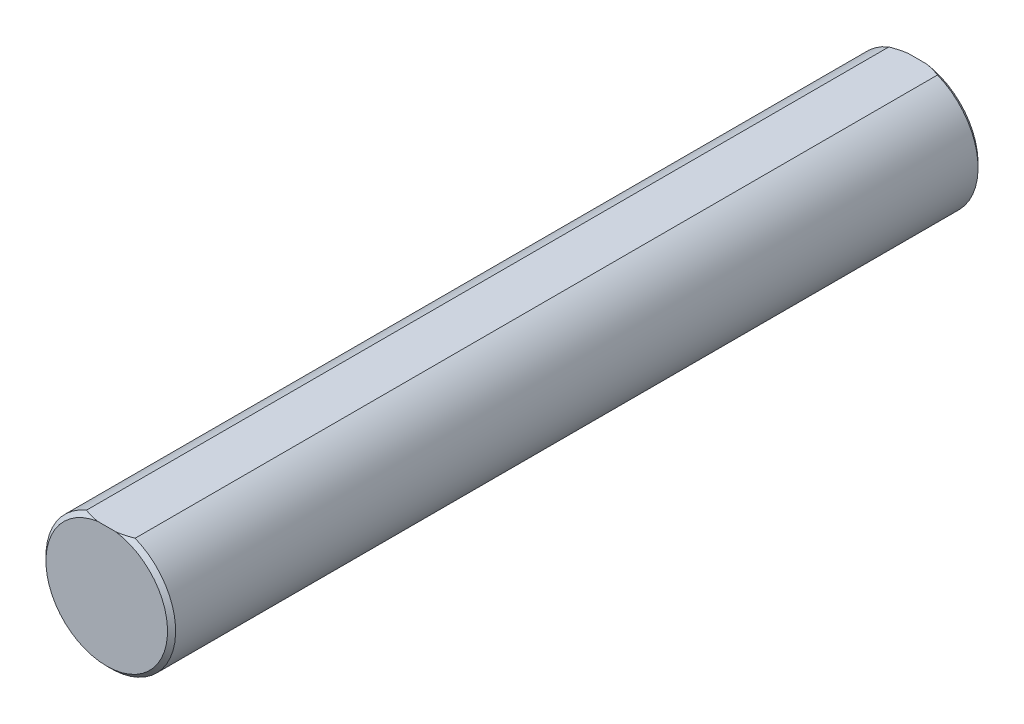
from build123d import *

# Parameters (mm, degrees)
SKETCH1_R           = 4
BOSS_EXTRUDE1_DEPTH = 50
CHAMFER1_SIZE       = 0.25
CHAMFER2_SIZE       = 0.25
CUT_EXTRUDE2_DEPTH  = 51.318982502


with BuildPart() as part:
    # Sketch1 → Boss-Extrude1 (new body)
    with BuildSketch(Plane.XY):
        Circle(SKETCH1_R)
    extrude(amount=BOSS_EXTRUDE1_DEPTH)

    # Chamfer1
    chamfer1_edges = [part.edges().sort_by_distance(p)[0] for p in [
        (-4, 0, 50),
    ]]
    chamfer(chamfer1_edges, length=CHAMFER1_SIZE)

    # Chamfer2
    chamfer2_edges = [part.edges().sort_by_distance(p)[0] for p in [
        (-4, 0, 0),
    ]]
    chamfer(chamfer2_edges, length=CHAMFER2_SIZE)

    # Sketch4 → Cut-Extrude2 (cut, through all)
    with BuildSketch(Plane.XY.offset(50)):
        with BuildLine():
            Line((-1.5, 3.708099244), (1.5, 3.708099244))
            ThreePointArc((1.5, 3.708099244), (0, 4), (-1.5, 3.708099244))
        make_face()
    extrude(amount=-CUT_EXTRUDE2_DEPTH, mode=Mode.SUBTRACT)


solid = part.part
